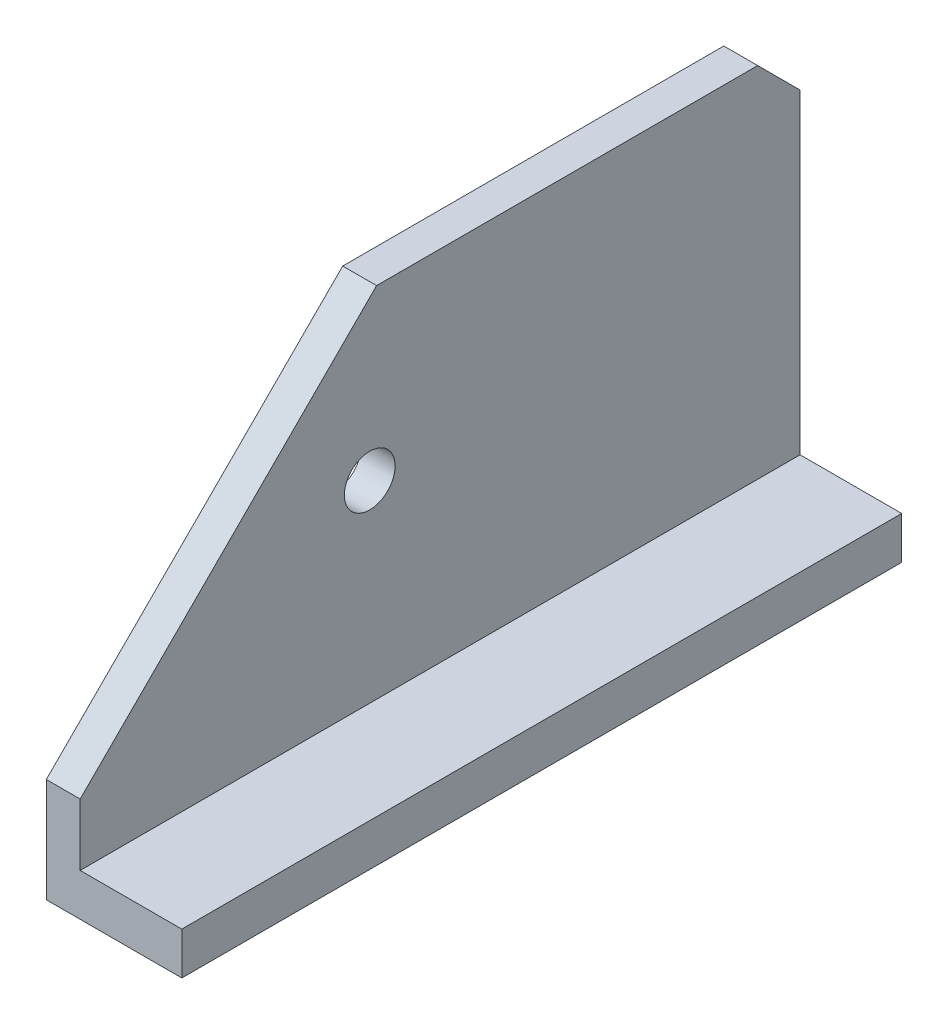
from build123d import *

# Parameters (mm, degrees)
EXTRUDE_1_DEPTH     = 85
SKETCH_2_R          = 3
CUT_EXTRUDE_1_DEPTH = 97.282345214
CHAMFER_1_SIZE      = 35
CHAMFER_2_SIZE      = 5


with BuildPart() as part:
    # Эскиз1 → Вытянуть1 (new body)
    with BuildSketch(Plane.XY):
        Polygon((0, 0), (12, 0), (12, -5), (-4, -5), (-4, 42.3), (0, 42.3), align=None)
    extrude(amount=EXTRUDE_1_DEPTH)

    # Эскиз2 → Вырез-Вытянуть1 (cut, through all)
    with BuildSketch(Plane.ZY.offset(4)):
        with Locations((50.813469235, 22.773427237)):
            Circle(SKETCH_2_R)
    extrude(amount=-CUT_EXTRUDE_1_DEPTH, mode=Mode.SUBTRACT)

    # Фаска1
    chamfer_1_edges = [part.edges().sort_by_distance(p)[0] for p in [
        (-2, 42.3, 85),
    ]]
    chamfer(chamfer_1_edges, length=CHAMFER_1_SIZE)

    # Фаска2
    chamfer_2_edges = [part.edges().sort_by_distance(p)[0] for p in [
        (-2, 42.3, 0),
    ]]
    chamfer(chamfer_2_edges, length=CHAMFER_2_SIZE)


solid = part.part
